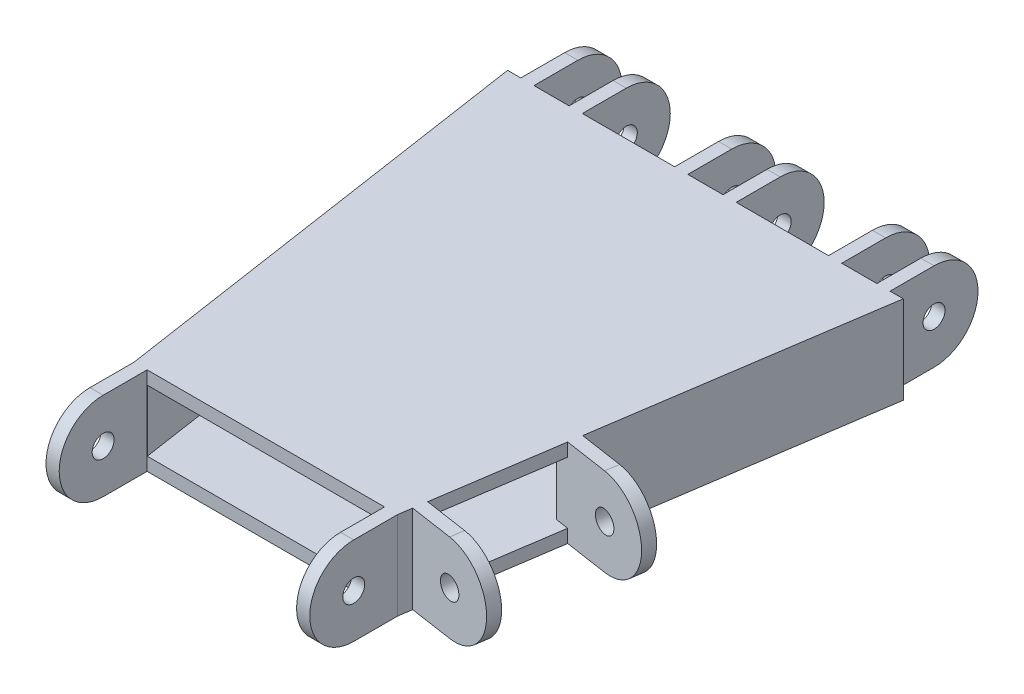
from build123d import *

# Parameters (mm, degrees)
BOSS_EXTRUDE1_DEPTH = 10
BOSS_EXTRUDE2_START = 35
SKETCH2_R           = 2.5
BOSS_EXTRUDE2_DEPTH = 7
LPATTERN1_COUNT     = 3
LPATTERN1_PITCH     = 35
SHELL1_T            = -3
SKETCH3_W           = 8
SKETCH3_H           = 20
CUT_EXTRUDE1_DEPTH  = 20
BOSS_EXTRUDE3_START = -3
SKETCH5_R           = 2.5
BOSS_EXTRUDE3_DEPTH = 3
LPATTERN2_COUNT     = 2
LPATTERN2_PITCH     = 31
SKETCH6_W           = 28
SKETCH6_H           = 14
CUT_EXTRUDE2_DEPTH  = 3
BOSS_EXTRUDE4_START = 30
SKETCH7_R           = 2.5
BOSS_EXTRUDE4_DEPTH = 3
LPATTERN3_COUNT     = 2
LPATTERN3_PITCH     = 57


with BuildPart() as part:
    # Sketch1 → Boss-Extrude1 (new, symmetric)
    with BuildSketch(Plane(origin=(0, 0, 0), x_dir=(1, 0, 0), z_dir=(0, 1, 0))):
        Polygon((-45, 0), (45, 0), (30, -100), (-30, -100), align=None)
    extrude(amount=BOSS_EXTRUDE1_DEPTH, both=True)

    # Sketch2 → Boss-Extrude2 (add, symmetric)
    with BuildSketch(Plane(origin=(0, 0, 0), x_dir=(0, 0, -1), z_dir=(1, 0, 0)).offset(BOSS_EXTRUDE2_START)):
        with BuildLine():
            Line((0, 10), (10, 10))
            ThreePointArc((10, 10), (20, 0), (10, -10))
            Line((10, -10), (0, -10))
            Line((0, -10), (0, 10))
        make_face()
        with Locations((10, 0)):
            Circle(SKETCH2_R, mode=Mode.SUBTRACT)
    boss_extrude2 = extrude(amount=BOSS_EXTRUDE2_DEPTH, both=True)

    # LPattern1: Boss-Extrude2 ×3
    with Locations(*[(-i * LPATTERN1_PITCH, 0, 0) for i in range(1, LPATTERN1_COUNT)]):
        add(boss_extrude2)

    # Shell1
    shell1_openings = [part.faces().sort_by_distance(p)[0] for p in [
        (0, 0, 100),
    ]]
    offset(amount=SHELL1_T, openings=shell1_openings, kind=Kind.INTERSECTION)

    # Sketch3 → Cut-Extrude1 (cut)
    with BuildSketch(Plane.XY):
        with Locations((35, 0)):
            Rectangle(SKETCH3_W, SKETCH3_H)
        Rectangle(SKETCH3_W, SKETCH3_H)
        with Locations((-35, 0)):
            Rectangle(SKETCH3_W, SKETCH3_H)
    extrude(amount=-CUT_EXTRUDE1_DEPTH, mode=Mode.SUBTRACT)

    # Sketch5 → Boss-Extrude3 (add)
    with BuildSketch(Plane(origin=(-14.009779951, 0, 93.398533007), x_dir=(0.9889363528682976, 0, 0.14834045293024437), z_dir=(-0.14834045293024437, 0, 0.9889363528682976)).offset(BOSS_EXTRUDE3_START)):
        with BuildLine():
            Line((44.502135879, 10), (54.502135879, 10))
            ThreePointArc((54.502135879, 10), (64.502135879, 0), (54.502135879, -10))
            Line((54.502135879, -10), (44.502135879, -10))
            Line((44.502135879, -10), (44.502135879, 10))
        make_face()
        with Locations((54.502135879, 0)):
            Circle(SKETCH5_R, mode=Mode.SUBTRACT)
    boss_extrude3 = extrude(amount=-BOSS_EXTRUDE3_DEPTH)

    # LPattern2: Boss-Extrude3 ×2
    with Locations(*[Vector(0.14834045293024434, 0, -0.9889363528682976) * (i * LPATTERN2_PITCH) for i in range(1, LPATTERN2_COUNT)]):
        add(boss_extrude3)

    # Sketch6 → Cut-Extrude2 (cut)
    with BuildSketch(Plane(origin=(44.009779951, 0, 6.601466993), x_dir=(0.14834045293024437, 0, -0.9889363528682976), z_dir=(0.9889363528682976, 0, 0.14834045293024437))):
        with Locations((-74.443421699, 0)):
            Rectangle(SKETCH6_W, SKETCH6_H)
    extrude(amount=-CUT_EXTRUDE2_DEPTH, mode=Mode.SUBTRACT)

    # Sketch7 → Boss-Extrude4 (add)
    with BuildSketch(Plane(origin=(0, 0, 0), x_dir=(0, 0, -1), z_dir=(1, 0, 0)).offset(BOSS_EXTRUDE4_START)):
        with BuildLine():
            Line((-100, 10), (-110, 10))
            ThreePointArc((-110, 10), (-120, 0), (-110, -10))
            Line((-110, -10), (-100, -10))
            Line((-100, -10), (-100, 10))
        make_face()
        with Locations((-110, 0)):
            Circle(SKETCH7_R, mode=Mode.SUBTRACT)
    boss_extrude4 = extrude(amount=-BOSS_EXTRUDE4_DEPTH)

    # LPattern3: Boss-Extrude4 ×2
    with Locations(*[(-i * LPATTERN3_PITCH, 0, 0) for i in range(1, LPATTERN3_COUNT)]):
        add(boss_extrude4)


solid = part.part
